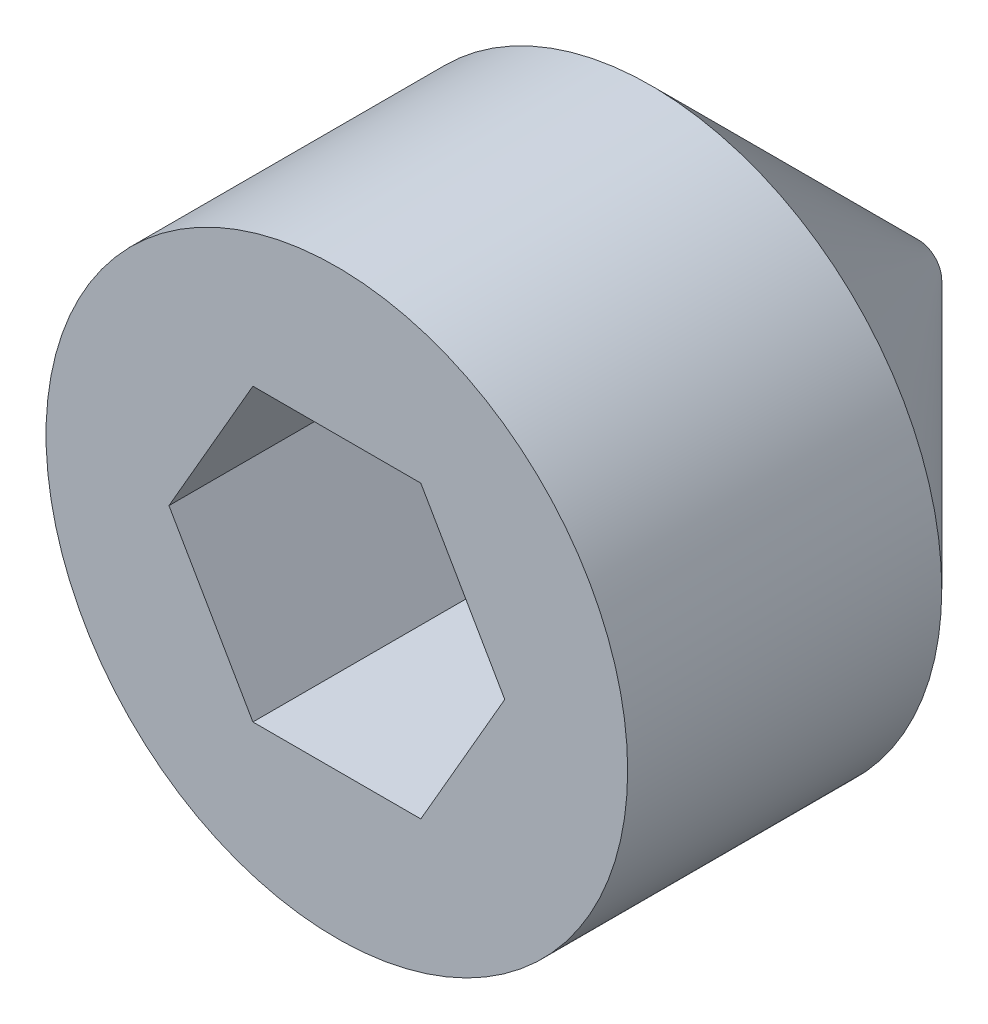
from build123d import *

# Parameters (mm, degrees)
SKETCH1_R           = 2.5
BOSS_EXTRUDE1_DEPTH = 5
CUT_EXTRUDE1_DEPTH  = 2


with BuildPart() as part:
    # Sketch1 → Boss-Extrude1 (new body)
    with BuildSketch(Plane.XY):
        Circle(SKETCH1_R)
    extrude(amount=-BOSS_EXTRUDE1_DEPTH)

    # Sketch2 → Cut-Extrude1 (cut)
    with BuildSketch(Plane.XY):
        Polygon((1.443375673, 0), (0.721687836, 1.25), (-0.721687836, 1.25), (-1.443375673, 0), (-0.721687836, -1.25), (0.721687836, -1.25), align=None)
    extrude(amount=-CUT_EXTRUDE1_DEPTH, mode=Mode.SUBTRACT)

    # Sketch3 → Chamfer 2 (revolve, cut)
    with BuildSketch(Plane(origin=(0, 0, 0), x_dir=(0, 0, -1), z_dir=(1, 0, 0)), mode=Mode.PRIVATE) as chamfer_2_sk:
        Polygon((5, 2.5), (5, 0.2), (2.7, 2.5), align=None)
    revolve(chamfer_2_sk.sketch.rotate(Axis((0, 0, 0), (0, 0, -1)), 90), axis=Axis((0, 0, 0), (0, 0, -1)), mode=Mode.SUBTRACT)


solid = part.part
